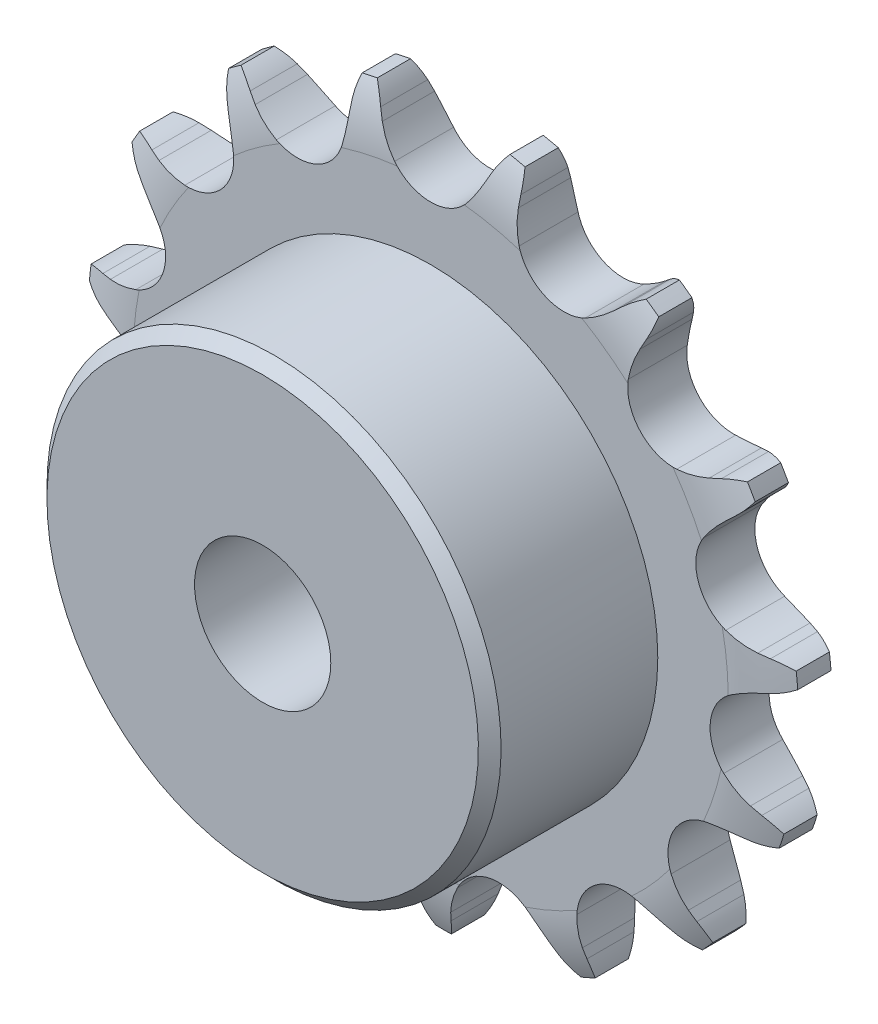
from build123d import *

# Parameters (mm, degrees)
CUT_EXTRUDE1_DEPTH      = 23.54315441
CIRPATTERN1_COUNT       = 15
BOSS_EXTRUDE1_START     = 1.3
SKETCH2_R               = 10
BOSS_EXTRUDE1_DEPTH     = 7.4
CUT_EXTRUDE2_DEPTH      = 25.083300715
CUT_EXTRUDE2_DEPTH_BACK = 25.083300715
SKETCH3_R               = 3
SKETCH4_W               = 1.95
SKETCH4_H               = 5.584687294
CUT_EXTRUDE3_DEPTH      = 25.083300715
CUT_EXTRUDE3_DEPTH_BACK = 25.083300715
SKETCH5_OUTSIDE_W       = 42.85
SKETCH5_OUTSIDE_H       = 42.678
SKETCH5_OUTSIDE_R       = 15.65


with BuildPart() as part:
    # Sketch1 → Revolve1 (revolve)
    with BuildSketch(Plane(origin=(0, 0, 0), x_dir=(0, 0, -1), z_dir=(1, 0, 0))):
        with BuildLine():
            Line((1.3, 0), (-1.3, 0))
            Line((-1.3, 0), (-1.3, 13.101418106))
            ThreePointArc((-1.3, 13.101418106), (-1.122370651, 14.550555781), (-0.6, 15.913890328))
            Line((-0.6, 15.913890328), (0.6, 15.913890328))
            ThreePointArc((0.6, 15.913890328), (1.122370651, 14.550555781), (1.3, 13.101418106))
            Line((1.3, 13.101418106), (1.3, 0))
        make_face()
    revolve(axis=Axis((0, 0, -1.3), (0, 0, 1)))

    # Sketch0 → Cut-Extrude1 (cut, symmetric)
    with BuildSketch(Plane.XY):
        with BuildLine():
            Line((5.458731892, -13.819129077), (5.192148114, -13.461913404))
            ThreePointArc((5.192148114, -13.461913404), (4.769815507, -12.963915887), (4.288911093, -12.522217685))
            ThreePointArc((4.288911093, -12.522217685), (2.574176066, -12.110546227), (1.175129538, -13.184072386))
            ThreePointArc((1.175129538, -13.184072386), (0.915456339, -13.78318522), (0.732190143, -14.409906736))
            Line((0.732190143, -14.409906736), (0.633946447, -14.844668882))
            ThreePointArc((0.633946447, -14.844668882), (-0.774190712, -16.881356201), (-3.200657759, -17.374512534))
            ThreePointArc((-3.200657759, -17.374512534), (3.673146461, -17.280795438), (9.99079726, -14.570582212))
            ThreePointArc((9.99079726, -14.570582212), (7.573524561, -15.106994545), (5.458731892, -13.819129077))
        make_face()
    cut_extrude1 = extrude(amount=CUT_EXTRUDE1_DEPTH, both=True, mode=Mode.SUBTRACT)

    # CirPattern1: Cut-Extrude1 ×15 about axis
    cirpattern1_axis = Axis((0, 0, 0), (0, 0, 1))
    for i in range(1, CIRPATTERN1_COUNT):
        add(cut_extrude1.rotate(cirpattern1_axis, i * 360 / CIRPATTERN1_COUNT), mode=Mode.SUBTRACT)

    # Sketch2 → Boss-Extrude1 (add)
    with BuildSketch(Plane.XY.offset(BOSS_EXTRUDE1_START)):
        with Locations(Location((0, 0, 0), (0, 0, 270))):
            Circle(SKETCH2_R)
    extrude(amount=BOSS_EXTRUDE1_DEPTH)

    # Sketch3 → Cut-Extrude2 (cut, two sides: drawn at the far end of the back side and taken through both)
    with BuildSketch(Plane.XY.offset(-CUT_EXTRUDE2_DEPTH_BACK)):
        Circle(SKETCH3_R)
    extrude(amount=CUT_EXTRUDE2_DEPTH + CUT_EXTRUDE2_DEPTH_BACK, mode=Mode.SUBTRACT)

    # Sketch4 → Cut-Revolve1 (revolve, cut)
    with BuildSketch(Plane(origin=(0, 0, 0), x_dir=(0, 0, -1), z_dir=(1, 0, 0))):
        Polygon((-8.7, 10), (-8.7, 9.5), (-8.2, 10), align=None)
        with Locations((-2.275, 13.121546681)):
            Rectangle(SKETCH4_W, SKETCH4_H)
    revolve(axis=Axis((0, 0, -1.3), (0, 0, 1)), mode=Mode.SUBTRACT)

    # Sketch5 outside → Cut-Extrude3 (cut, two sides: drawn at the far end of the back side and taken through both)
    with BuildSketch(Plane.XY.offset(-CUT_EXTRUDE3_DEPTH_BACK)):
        with Locations((0, -0.155)):
            Rectangle(SKETCH5_OUTSIDE_W, SKETCH5_OUTSIDE_H)
        Circle(SKETCH5_OUTSIDE_R, mode=Mode.SUBTRACT)
    extrude(amount=CUT_EXTRUDE3_DEPTH + CUT_EXTRUDE3_DEPTH_BACK, mode=Mode.SUBTRACT)


solid = part.part
